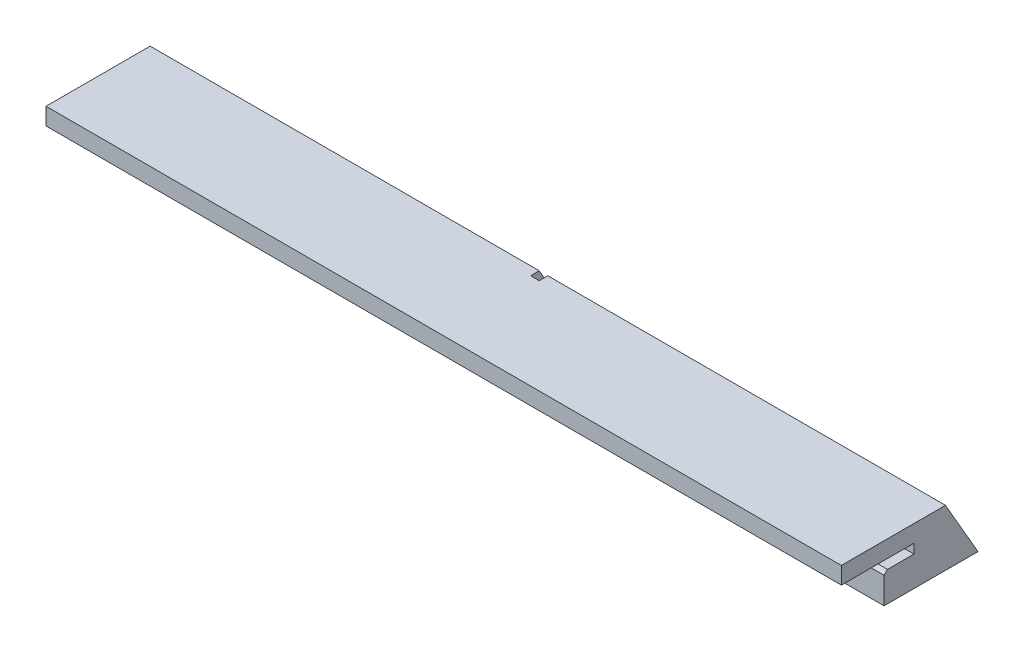
from build123d import *

# Parameters (mm, degrees)
SKETCH_2_W                  = 93.1
SKETCH_2_H                  = 10
EXTRUDE_1_DEPTH             = 3.5
SKETCH_4_W                  = 93.1
SKETCH_4_H                  = 6.5
EXTRUDE_2_DEPTH             = 1.1
SKETCH_5_W                  = 93.1
SKETCH_5_H                  = 10
EXTRUDE_3_DEPTH             = 2
CUT_EXTRUDE_1_DEPTH         = 94.867832616
SKETCH_7_W                  = 83.1
SKETCH_7_H                  = 1.1
EXTRUDE_4_DEPTH             = 3.5
CHAMFER_1_SIZE              = 0.4
CUT_EXTRUDE_2_REACH         = 95.868
SKETCH_8_R                  = 150
SKETCH_9_W                  = 93.1
SKETCH_9_H                  = 2
EXTRUDE_5_DEPTH             = 5
EXTRUDE_5_DIRECTION_2_REACH = 95.868
SKETCH_10_W                 = 93.1
SKETCH_10_H                 = 7.621023553
EXTRUDE_6_DEPTH             = 1
SKETCH_11_W                 = 1
SKETCH_11_H                 = 7.621023553
CUT_EXTRUDE_3_DEPTH         = 1


with BuildPart() as part:
    # 草图2 → 凸台-拉伸1 (new body)
    with BuildSketch(Plane(origin=(0, 0, 0), x_dir=(1, 0, 0), z_dir=(0, 1, 0))):
        with Locations((46.55, 5)):
            Rectangle(SKETCH_2_W, SKETCH_2_H)
    extrude(amount=EXTRUDE_1_DEPTH)

    # 草图4 → 凸台-拉伸2 (add)
    with BuildSketch(Plane(origin=(0, 3.5, 0), x_dir=(1, 0, 0), z_dir=(0, 1, 0))):
        with Locations((46.55, 6.75)):
            Rectangle(SKETCH_4_W, SKETCH_4_H)
    extrude(amount=EXTRUDE_2_DEPTH)

    # 草图5 → 凸台-拉伸3 (add)
    with BuildSketch(Plane(origin=(0, 4.6, 0), x_dir=(1, 0, 0), z_dir=(0, 1, 0))):
        with Locations((46.55, 5)):
            Rectangle(SKETCH_5_W, SKETCH_5_H)
    extrude(amount=EXTRUDE_3_DEPTH)

    # 草图6 → 切除-拉伸1 (cut, through all)
    with BuildSketch(Plane.ZY):
        Polygon((-10, 0), (-6.189488223, 6.6), (-10, 6.6), align=None)
    extrude(amount=-CUT_EXTRUDE_1_DEPTH, mode=Mode.SUBTRACT)

    # 草图7 → 凸台-拉伸4 (add)
    with BuildSketch(Plane.XY.offset(-3.5)):
        with Locations((46.55, 4.05)):
            Rectangle(SKETCH_7_W, SKETCH_7_H)
    extrude(amount=EXTRUDE_4_DEPTH)

    # 倒角1
    chamfer_1_edges = [part.edges().sort_by_distance(p)[0] for p in [
        (90.6, 3.5, 0),
        (2.5, 3.5, 0),
    ]]
    chamfer(chamfer_1_edges, length=CHAMFER_1_SIZE)

    # 草图8 → 切除-拉伸2 (cut, up to next)
    with BuildSketch(Plane.XZ, mode=Mode.PRIVATE) as cut_extrude_2_sk1:
        with Locations((46.55, 147)):
            Circle(SKETCH_8_R)
    cut_extrude_2_tool1 = extrude(cut_extrude_2_sk1.sketch, amount=-CUT_EXTRUDE_2_REACH, mode=Mode.PRIVATE) & part.part
    add(cut_extrude_2_tool1.solids().sort_by_distance((46.55, 0, 147))[0], mode=Mode.SUBTRACT)

    # 草图9 → 凸台-拉伸5 (add)
    with BuildSketch(Plane.XY):
        with Locations((46.55, 5.6)):
            Rectangle(SKETCH_9_W, SKETCH_9_H)
    extrude(amount=EXTRUDE_5_DEPTH)

    # 草图9 → 凸台-拉伸5 direction 2 (add, up to next)
    with BuildSketch(Plane.XY, mode=Mode.PRIVATE) as extrude_5_direction_2_sk1:
        with Locations((46.55, 5.6)):
            Rectangle(SKETCH_9_W, SKETCH_9_H)
    extrude_5_direction_2_tool1 = extrude(extrude_5_direction_2_sk1.sketch, amount=-EXTRUDE_5_DIRECTION_2_REACH, mode=Mode.PRIVATE) - part.part
    add(extrude_5_direction_2_tool1.solids().sort_by_distance((46.55, 5.6, 0))[0])

    # 草图10 → 凸台-拉伸6 (add, along a direction that is not the sketch's normal)
    with BuildSketch(Plane(origin=(0, 4.330127019, -7.5), x_dir=(-1, 0, 0), z_dir=(0, 0.4999999999999947, -0.8660254037844417))):
        with Locations((-46.55, -1.189488223)):
            Rectangle(SKETCH_10_W, SKETCH_10_H)
    extrude(amount=EXTRUDE_6_DEPTH, dir=(0, 0, -1))

    # 草图11 → 切除-拉伸3 (cut, along a direction that is not the sketch's normal)
    with BuildSketch(Plane(origin=(0, 4.763139721, -8.25), x_dir=(-1, 0, 0), z_dir=(0, 0.49999999999999484, -0.8660254037844418))):
        with Locations((-46.05, -1.689488223)):
            Rectangle(SKETCH_11_W, SKETCH_11_H)
    extrude(amount=-CUT_EXTRUDE_3_DEPTH, dir=(0, 0, -1), mode=Mode.SUBTRACT)


solid = part.part
